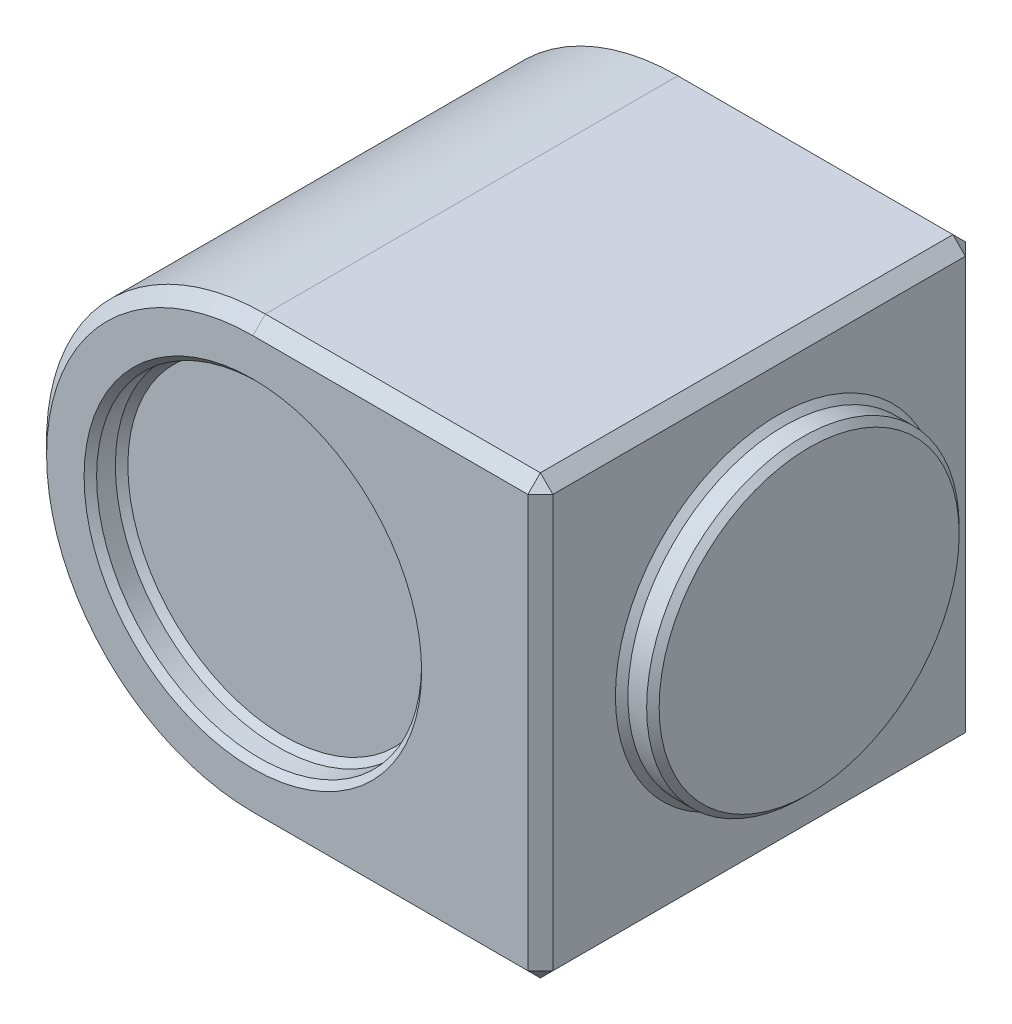
from build123d import *

# Parameters (mm, degrees)
BOSS_EXTRUDE1_DEPTH = 70
SKETCH4_R           = 25
BOSS_EXTRUDE2_DEPTH = 5
CHAMFER1_SIZE       = 2
SKETCH5_R           = 26
CUT_EXTRUDE1_DEPTH  = 5
CHAMFER3_SIZE       = 1


with BuildPart() as part:
    # Sketch3 → Boss-Extrude1 (new body)
    with BuildSketch(Plane.XY):
        with BuildLine():
            Line((0, 35), (46, 35))
            Line((46, 35), (46, -35))
            Line((46, -35), (0, -35))
            ThreePointArc((0, -35), (-35, 0), (0, 35))
        make_face()
    extrude(amount=BOSS_EXTRUDE1_DEPTH)

    # Sketch4 → Boss-Extrude2 (add)
    with BuildSketch(Plane(origin=(46, 0, 0), x_dir=(0, 0, -1), z_dir=(1, 0, 0))):
        with Locations(Location((-38, 0, 0), (0, 0, 180))):
            Circle(SKETCH4_R)
    extrude(amount=BOSS_EXTRUDE2_DEPTH)

    # Chamfer1
    chamfer1_edges = [part.edges().sort_by_distance(p)[0] for p in [
        (46, 0, 70),
        (23, 35, 70),
        (-35, 0, 70),
        (23, 35, 0),
        (46, 0, 0),
        (23, -35, 0),
        (-35, 0, 0),
        (23, -35, 70),
        (46, 35, 35),
        (46, -35, 35),
    ]]
    chamfer(chamfer1_edges, length=CHAMFER1_SIZE)

    # Sketch5 → Cut-Extrude1 (cut)
    with BuildSketch(Plane(origin=(0, 0, 0), x_dir=(-1, 0, 0), z_dir=(0, 0, -1))):
        Circle(SKETCH5_R)
    extrude(amount=-CUT_EXTRUDE1_DEPTH, mode=Mode.SUBTRACT)

    # Chamfer3
    chamfer3_edges = [part.edges().sort_by_distance(p)[0] for p in [
        (46, 0, 13),
        (51, 0, 13),
        (26, 0, 5),
        (26, 0, 0),
    ]]
    chamfer(chamfer3_edges, length=CHAMFER3_SIZE)


with BuildPart() as body_2:
    # Mirror1: mirrored copy
    add(part.part.mirror(Plane.XY))


solid = body_2.part
